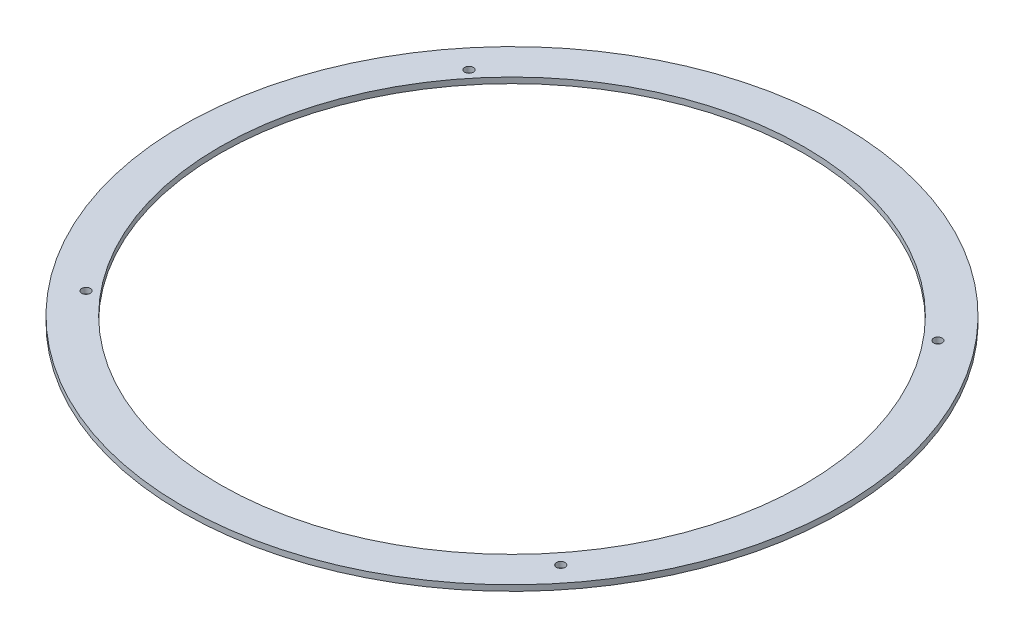
from build123d import *

# Parameters (mm, degrees)
SKETCH_1_R      = 115
SKETCH_1_R_2    = 102
SKETCH_1_R_3    = 1.5
EXTRUDE_1_DEPTH = 2


with BuildPart() as part:
    # 草图1 → 凸台-拉伸1 (new body)
    with BuildSketch(Plane(origin=(0, 0, 0), x_dir=(1, 0, 0), z_dir=(0, 1, 0))):
        with Locations(Location((0, 0, 0), (0, 0, 270))):
            Circle(SKETCH_1_R)
        with Locations(Location((0, 0, 0), (0, 0, 270))):
            Circle(SKETCH_1_R_2, mode=Mode.SUBTRACT)
        with Locations(Location((-81.819805153, 66.819805153, 0), (0, 0, 270))):
            Circle(SKETCH_1_R_3, mode=Mode.SUBTRACT)
        with Locations(Location((-81.819805153, -66.819805153, 0), (0, 0, 270))):
            Circle(SKETCH_1_R_3, mode=Mode.SUBTRACT)
        with Locations(Location((83.819805153, -66.819805153, 0), (0, 0, 270))):
            Circle(SKETCH_1_R_3, mode=Mode.SUBTRACT)
        with Locations(Location((81.819805153, 66.819805153, 0), (0, 0, 270))):
            Circle(SKETCH_1_R_3, mode=Mode.SUBTRACT)
    extrude(amount=EXTRUDE_1_DEPTH)


solid = part.part
